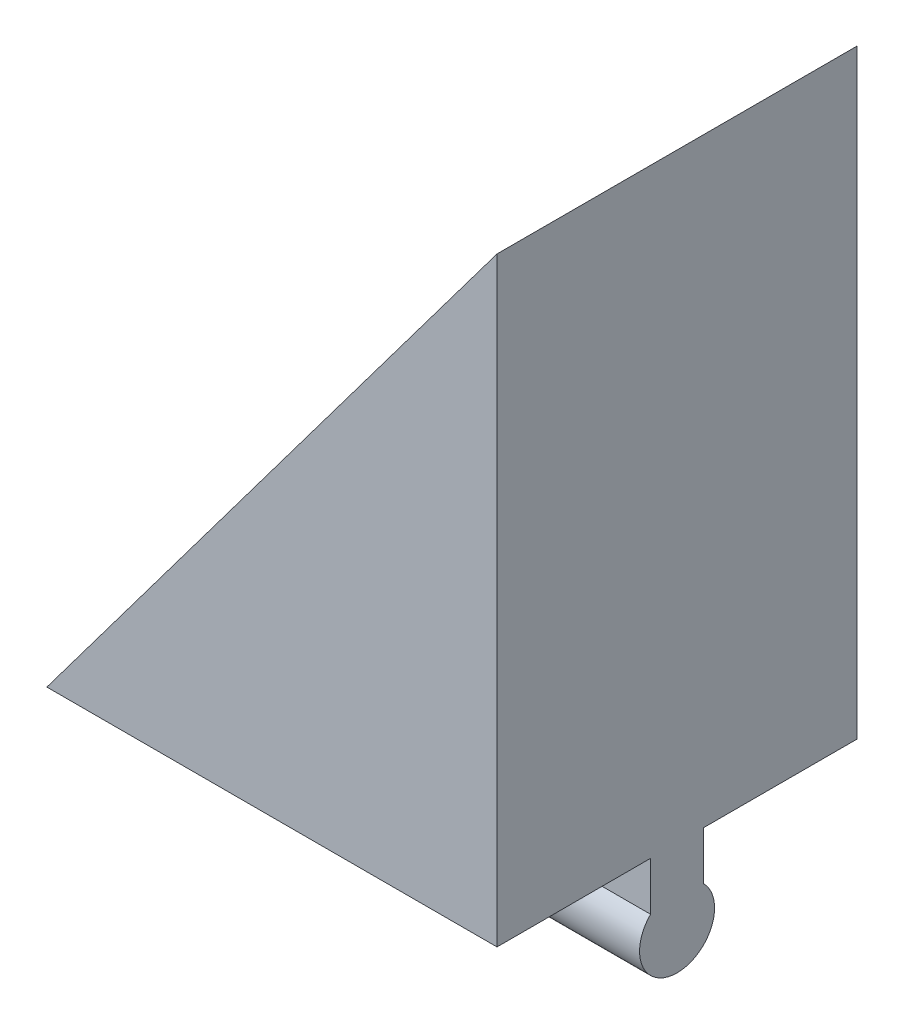
from build123d import *

# Parameters (mm, degrees)
SKETCH_1_W          = 30
SKETCH_1_H          = 6
EXTRUDE_1_DEPTH     = 24
SKETCH_2_W          = 16
SKETCH_2_H          = 6
CUT_EXTRUDE_1_DEPTH = 45.777226354
SKETCH_3_W          = 4
SKETCH_3_H          = 4
EXTRUDE_2_DEPTH     = 30
SKETCH_4_W          = 26
SKETCH_4_H          = 4
EXTRUDE_3_DEPTH     = 10
SKETCH_5_W          = 4
SKETCH_5_H          = 10
CUT_EXTRUDE_3_DEPTH = 47.957427527
SKETCH_6_W          = 4
SKETCH_6_H          = 10
CUT_EXTRUDE_5_DEPTH = 47.957427527
SKETCH_7_R          = 4
EXTRUDE_5_DEPTH     = 30
SKETCH_8_R          = 4
CUT_EXTRUDE_6_DEPTH = 4
SKETCH_9_R          = 4
CUT_EXTRUDE_7_DEPTH = 44.324358045
SKETCH_10_W         = 3.23
SKETCH_10_H         = 3.54
EXTRUDE_6_DEPTH     = 30
SKETCH_11_W         = 3.23
SKETCH_11_H         = 3.54
CUT_EXTRUDE_8_DEPTH = 45.777226354
EXTRUDE_7_DEPTH     = 30


with BuildPart() as part:
    # 草图1 → 凸台-拉伸1 (new body)
    with BuildSketch(Plane.XY):
        Polygon((15, 23), (-15, -17), (15, -17), align=None)
        with Locations((0, -20)):
            Rectangle(SKETCH_1_W, SKETCH_1_H)
    extrude(amount=EXTRUDE_1_DEPTH)

    # 草图2 → 切除-拉伸1 (cut, through all)
    with BuildSketch(Plane.ZY.offset(15)):
        with Locations((12, -20)):
            Rectangle(SKETCH_2_W, SKETCH_2_H)
    extrude(amount=-CUT_EXTRUDE_1_DEPTH, mode=Mode.SUBTRACT)

    # 草图3 → 凸台-拉伸2 (add)
    with BuildSketch(Plane.ZY.offset(15)):
        with Locations((2, -25)):
            Rectangle(SKETCH_3_W, SKETCH_3_H)
        with Locations((22, -25)):
            Rectangle(SKETCH_3_W, SKETCH_3_H)
    extrude(amount=-EXTRUDE_2_DEPTH)

    # 草图4 → 凸台-拉伸3 (add)
    with BuildSketch(Plane.XZ.offset(17)):
        with Locations((-2, 12)):
            Rectangle(SKETCH_4_W, SKETCH_4_H)
    extrude(amount=EXTRUDE_3_DEPTH)

    # 草图5 → 切除-拉伸3 (cut, through all)
    with BuildSketch(Plane(origin=(15, 0, 0), x_dir=(0, 0, -1), z_dir=(1, 0, 0))):
        with Locations((-2, -22)):
            Rectangle(SKETCH_5_W, SKETCH_5_H)
        with Locations((-22, -22)):
            Rectangle(SKETCH_5_W, SKETCH_5_H)
    extrude(amount=-CUT_EXTRUDE_3_DEPTH, mode=Mode.SUBTRACT)

    # 草图6 → 切除-拉伸5 (cut, through all)
    with BuildSketch(Plane.ZY.offset(15)):
        with Locations((12, -22)):
            Rectangle(SKETCH_6_W, SKETCH_6_H)
    extrude(amount=-CUT_EXTRUDE_5_DEPTH, mode=Mode.SUBTRACT)

    # 草图10 → 凸台-拉伸6 (add)
    with BuildSketch(Plane(origin=(15, 0, 0), x_dir=(0, 0, -1), z_dir=(1, 0, 0))):
        with Locations((-12, -18.77)):
            Rectangle(SKETCH_10_W, SKETCH_10_H)
    extrude(amount=-EXTRUDE_6_DEPTH)

    # 草图11 → 切除-拉伸8 (cut, through all)
    with BuildSketch(Plane(origin=(15, 0, 0), x_dir=(0, 0, -1), z_dir=(1, 0, 0))):
        with Locations((-12, -18.77)):
            Rectangle(SKETCH_11_W, SKETCH_11_H)
    extrude(amount=-CUT_EXTRUDE_8_DEPTH, mode=Mode.SUBTRACT)

    # 草图12 → 凸台-拉伸7 (add)
    with BuildSketch(Plane(origin=(15, 0, 0), x_dir=(0, 0, -1), z_dir=(1, 0, 0))):
        Polygon((-13.767766953, -20.23), (-12, -21.997766953), (-10.232233047, -20.23), align=None)
        with BuildLine():
            Line((-10.232233047, -20.23), (-12, -21.997766953))
            Line((-12, -21.997766953), (-13.767766953, -20.23))
            ThreePointArc((-13.767766953, -20.23), (-12.956708581, -24.307465784), (-9.5, -21.997766953))
            ThreePointArc((-9.5, -21.997766953), (-9.690301169, -21.041058372), (-10.232233047, -20.23))
        make_face()
        with BuildLine():
            ThreePointArc((-13.767766953, -20.23), (-12, -19.497766953), (-10.232233047, -20.23))
            Line((-10.232233047, -20.23), (-10.232233047, -17))
            Line((-10.232233047, -17), (-13.767766953, -17))
            Line((-13.767766953, -17), (-13.767766953, -20.23))
        make_face()
        with BuildLine():
            Line((-13.767766953, -20.23), (-10.232233047, -20.23))
            ThreePointArc((-10.232233047, -20.23), (-12, -19.497766953), (-13.767766953, -20.23))
        make_face()
    extrude(amount=-EXTRUDE_7_DEPTH)


with BuildPart() as body_2:
    # 草图7 → 凸台-拉伸5 (new body)
    with BuildSketch(Plane(origin=(15, 0, 0), x_dir=(0, 0, -1), z_dir=(1, 0, 0))):
        with Locations((-12, -21)):
            Circle(SKETCH_7_R)
    extrude(amount=-EXTRUDE_5_DEPTH)

    # 草图8 → 切除-拉伸6 (cut)
    with BuildSketch(Plane(origin=(15, 0, 0), x_dir=(0, 0, -1), z_dir=(1, 0, 0))):
        with Locations((-12, -21)):
            Circle(SKETCH_8_R)
    extrude(amount=-CUT_EXTRUDE_6_DEPTH, mode=Mode.SUBTRACT)

    # 草图9 → 切除-拉伸7 (cut, through all)
    with BuildSketch(Plane(origin=(11, 0, 0), x_dir=(0, 0, -1), z_dir=(1, 0, 0))):
        with Locations((-12, -21)):
            Circle(SKETCH_9_R)
    extrude(amount=-CUT_EXTRUDE_7_DEPTH, mode=Mode.SUBTRACT)


solid = part.part
